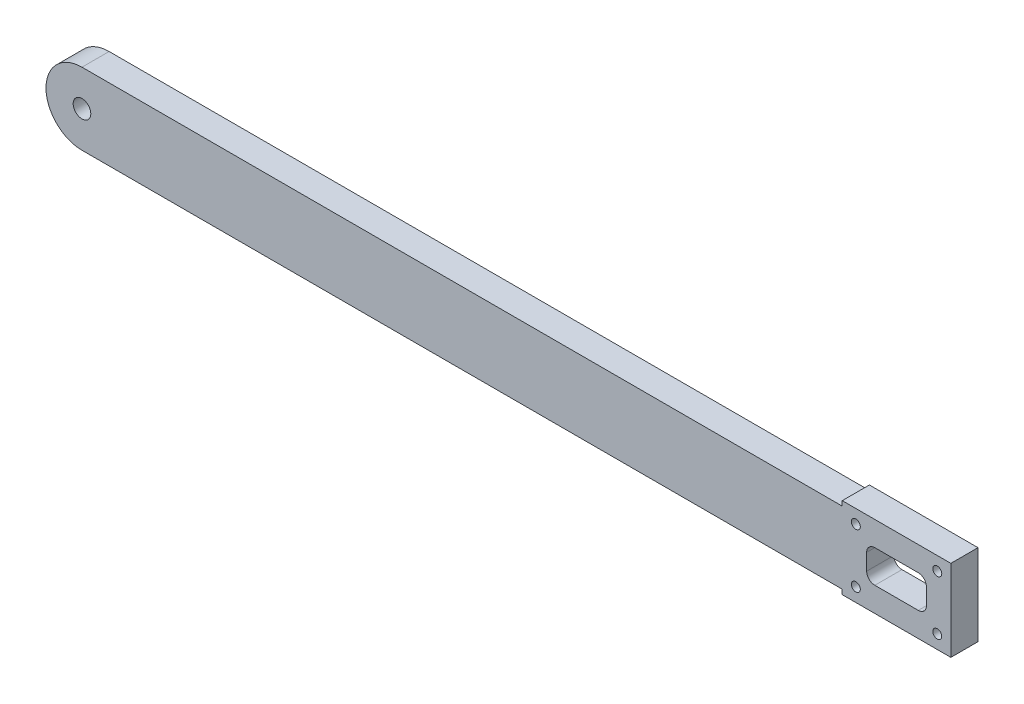
from build123d import *

# Parameters (mm, degrees)
SKETCH1_R      = 3.25
SKETCH1_R_2    = 1.65
MAIN_ARM_DEPTH = 10


with BuildPart() as part:
    # Sketch1 → Main Arm (new body)
    with BuildSketch(Plane.XY):
        with BuildLine():
            Line((280, 13.25), (0, 13.25))
            ThreePointArc((0, 13.25), (-13.25, 0), (0, -13.25))
            Line((0, -13.25), (280, -13.25))
            Line((280, -13.25), (280, -15))
            Line((280, -15), (320, -15))
            Line((320, -15), (320, 15))
            Line((320, 15), (280, 15))
            Line((280, 15), (280, 13.25))
        make_face()
        Circle(SKETCH1_R, mode=Mode.SUBTRACT)
        with Locations((285, 10)):
            Circle(SKETCH1_R_2, mode=Mode.SUBTRACT)
        with Locations((285, -10)):
            Circle(SKETCH1_R_2, mode=Mode.SUBTRACT)
        with BuildLine():
            Line((308, -6), (292, -6))
            ThreePointArc((292, -6), (289.878679656, -5.121320344), (289, -3))
            Line((289, -3), (289, 3))
            ThreePointArc((289, 3), (289.878679656, 5.121320344), (292, 6))
            Line((292, 6), (308, 6))
            ThreePointArc((308, 6), (310.121320344, 5.121320344), (311, 3))
            Line((311, 3), (311, -3))
            ThreePointArc((311, -3), (310.121320344, -5.121320344), (308, -6))
        make_face(mode=Mode.SUBTRACT)
        with Locations((315, 10)):
            Circle(SKETCH1_R_2, mode=Mode.SUBTRACT)
        with Locations((315, -10)):
            Circle(SKETCH1_R_2, mode=Mode.SUBTRACT)
    extrude(amount=MAIN_ARM_DEPTH)


solid = part.part
